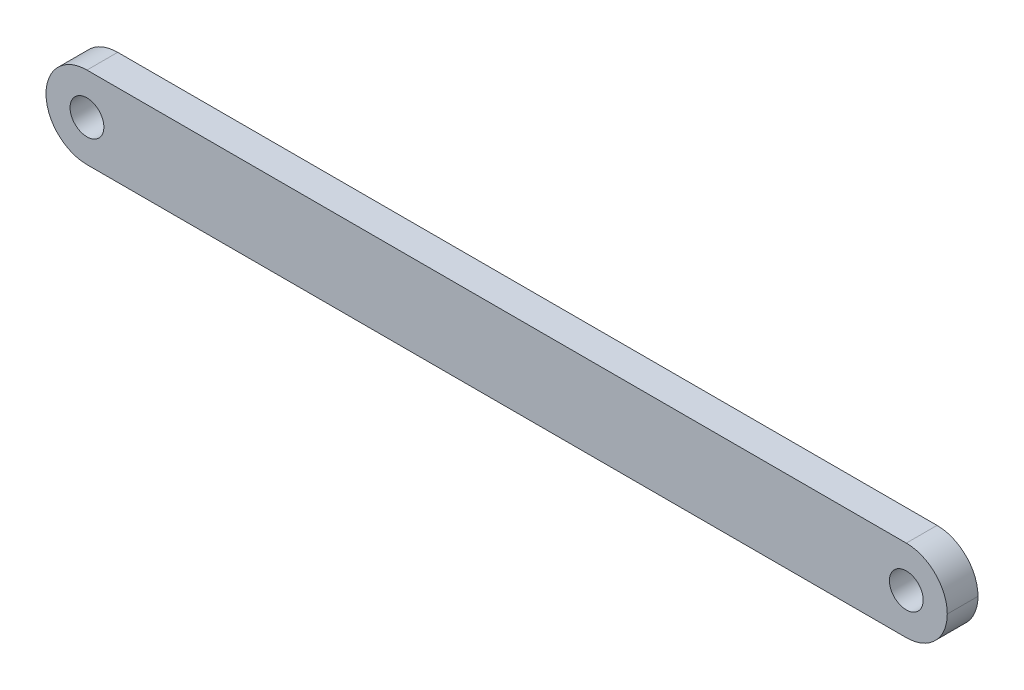
from build123d import *

# Parameters (mm, degrees)
SKETCH_1_R          = 1.3
SKETCH_1_R_2        = 1.65
EXTRUDE_1_DEPTH     = 3
SKETCH_2_R          = 1.65
CUT_EXTRUDE_1_DEPTH = 61.466769186
CUT_EXTRUDE_2_DEPTH = 1


with BuildPart() as part:
    # 草图1 → 凸台-拉伸1 (new body)
    with BuildSketch(Plane(origin=(0, 0, 0), x_dir=(-1, 0, 0), z_dir=(0, 0, -1))):
        with BuildLine():
            Line((-55.860221974, 0), (24.13832066, 0))
            ThreePointArc((24.13832066, 0), (26.966394209, 1.171219344), (28.138320535, 3.999))
            ThreePointArc((28.138320535, 3.999), (26.96674766, 6.827427125), (24.138320535, 7.999))
            Line((24.138320535, 7.999), (-55.860222099, 7.999))
            ThreePointArc((-55.860222099, 7.999), (-58.688295648, 6.827780656), (-59.860221974, 4))
            ThreePointArc((-59.860221974, 4), (-58.688649099, 1.171572875), (-55.860221974, 0))
        make_face()
        with Locations((24.138809001, 3.998511534)):
            Circle(SKETCH_1_R, mode=Mode.SUBTRACT)
        with Locations((-55.859733508, 3.999511534)):
            Circle(SKETCH_1_R_2, mode=Mode.SUBTRACT)
    extrude(amount=-EXTRUDE_1_DEPTH)

    # 草图2 → 切除-拉伸1 (cut, through all)
    with BuildSketch(Plane.XY.offset(3)):
        with Locations((-24.138809001, 3.998511534)):
            Circle(SKETCH_2_R)
    extrude(amount=-CUT_EXTRUDE_1_DEPTH, mode=Mode.SUBTRACT)

    # 草图3 → 切除-拉伸2 (cut)
    with BuildSketch(Plane(origin=(0, 0, 0), x_dir=(-1, 0, 0), z_dir=(0, 0, -1))):
        with BuildLine():
            Line((-16.710668713, 5.336154662), (-16.468781693, 5.146150656))
            Line((-16.468781693, 5.146150656), (-17.393561341, 3.731987996))
            add(Edge.make_bspline(
                [(-17.393561341, 3.731987996), (-17.331991064, 3.741801856), (-17.211891277, 3.760944901), (-17.090325379, 3.764102847), (-17.031081373, 3.765641842)],
                knots=[0, 0, 0, 0, 1.025318673, 2, 2, 2, 2], degree=3))
            add(Edge.make_bspline(
                [(-17.031081373, 3.765641842), (-16.995508877, 3.76468573), (-16.925485476, 3.762803653), (-16.822678674, 3.748319802), (-16.723889738, 3.72549469), (-16.629528126, 3.692222434), (-16.539255144, 3.64972008), (-16.452552748, 3.59878121), (-16.371050738, 3.536775529), (-16.293699558, 3.467510573), (-16.223472461, 3.390793589), (-16.161296405, 3.309392252), (-16.109069614, 3.223391371), (-16.066695692, 3.132834505), (-16.033790813, 3.037861246), (-16.009803168, 2.938593106), (-15.995623576, 2.834961635), (-15.993698085, 2.76448346), (-15.992719995, 2.728682707)],
                knots=[0, 0, 0, 0, 1.04369286, 2.054478336, 3.041073146, 4.015093852, 4.984733326, 5.965804835, 6.960378782, 7.985147595, 9.009457201, 10.008161701, 10.986880575, 11.956520048, 12.937015923, 13.931873656, 14.949455224, 16, 16, 16, 16], degree=3))
            add(Edge.make_bspline(
                [(-15.992719995, 2.728682707), (-15.9941431, 2.679703003), (-15.996943433, 2.583322537), (-16.024847229, 2.442945831), (-16.068206874, 2.309213315), (-16.130184402, 2.184260144), (-16.207166785, 2.068257574), (-16.301044378, 1.965472109), (-16.408487866, 1.873802072), (-16.529974665, 1.797145453), (-16.660717629, 1.734542402), (-16.798069626, 1.689577159), (-16.940696772, 1.66189369), (-17.03750138, 1.658423087), (-17.086469995, 1.656667483)],
                knots=[0, 0, 0, 0, 1.031375318, 2.029502543, 3.004789286, 3.987476834, 4.960371455, 5.9300674, 6.912260825, 7.929083631, 8.949397511, 9.960523116, 10.96833055, 12, 12, 12, 12], degree=3))
            add(Edge.make_bspline(
                [(-17.086469995, 1.656667483), (-17.133566695, 1.658195689), (-17.226857013, 1.661222797), (-17.364089808, 1.688188735), (-17.495952825, 1.731895837), (-17.621522206, 1.792110116), (-17.737842819, 1.868167999), (-17.841908455, 1.959730278), (-17.93320023, 2.064839743), (-18.009174851, 2.18348009), (-18.069433583, 2.310970048), (-18.114623508, 2.443907204), (-18.141019751, 2.581807186), (-18.144708308, 2.675288325), (-18.146566149, 2.722372611)],
                knots=[0, 0, 0, 0, 1.012016664, 2.004627821, 2.994792927, 3.992885782, 4.990978636, 5.973936114, 6.964471063, 7.975201453, 8.993600317, 9.990122807, 10.98767138, 12, 12, 12, 12], degree=3))
            add(Edge.make_bspline(
                [(-18.146566149, 2.722372611), (-18.145384704, 2.758417194), (-18.142972419, 2.832013346), (-18.126129028, 2.943477374), (-18.099064233, 3.057528456), (-18.068753987, 3.15428265), (-18.036728377, 3.233544172), (-18.010075837, 3.297447662), (-17.976901841, 3.363208735), (-17.94152846, 3.433082371), (-17.900771591, 3.505267804), (-17.856455942, 3.580971474), (-17.807356291, 3.658989401), (-17.772936128, 3.711933596), (-17.755340187, 3.738999214)],
                knots=[0, 0, 0, 0, 1.173818275, 2.396712641, 3.66331629, 4.989737886, 5.693666774, 6.447286557, 7.243889047, 8.091586357, 8.998013824, 9.943181721, 10.948533338, 12, 12, 12, 12], degree=3))
            Line((-17.755340187, 3.738999214), (-16.710668713, 5.336154662))
        make_face()
        with BuildLine():
            add(Edge.make_bspline(
                [(-17.096986822, 3.406667483), (-17.123649066, 3.405889439), (-17.175728176, 3.404369694), (-17.252135591, 3.395544442), (-17.324448842, 3.378925376), (-17.393625976, 3.357759044), (-17.458373679, 3.328655985), (-17.519162518, 3.293304186), (-17.57622757, 3.251683008), (-17.628971122, 3.204382096), (-17.676790785, 3.152594064), (-17.717971916, 3.097124541), (-17.753494316, 3.039310338), (-17.782376135, 2.978668396), (-17.804866211, 2.915221896), (-17.821134462, 2.849262647), (-17.830188213, 2.780348341), (-17.831694444, 2.733615838), (-17.832463584, 2.709752419)],
                knots=[0, 0, 0, 0, 1.129588631, 2.206414736, 3.251139165, 4.268635594, 5.265702196, 6.250456724, 7.242448911, 8.251968645, 9.246821453, 10.222880186, 11.173611482, 12.116736599, 13.062300278, 14.020270554, 14.989073742, 16, 16, 16, 16], degree=3))
            add(Edge.make_bspline(
                [(-17.832463584, 2.709752419), (-17.831837223, 2.686102439), (-17.830609021, 2.639728349), (-17.819456701, 2.57138917), (-17.802421619, 2.505624261), (-17.777081223, 2.442772662), (-17.746854335, 2.381876344), (-17.706949011, 2.325141059), (-17.662732225, 2.269120989), (-17.609878292, 2.218119517), (-17.553154929, 2.170662893), (-17.492553726, 2.12918264), (-17.429393766, 2.093696466), (-17.362822344, 2.065885369), (-17.29378396, 2.043061082), (-17.221703406, 2.026999603), (-17.146530551, 2.017919077), (-17.095608613, 2.016410883), (-17.069643072, 2.015641842)],
                knots=[0, 0, 0, 0, 0.989467248, 1.94019797, 2.891935182, 3.827694429, 4.772920941, 5.730924762, 6.725747692, 7.756678648, 8.79901574, 9.819492441, 10.826891316, 11.826466727, 12.835195252, 13.867842842, 14.912794438, 16, 16, 16, 16], degree=3))
            add(Edge.make_bspline(
                [(-17.069643072, 2.015641842), (-17.043677573, 2.016410943), (-16.992755718, 2.017919255), (-16.917582258, 2.026998924), (-16.84550394, 2.043063572), (-16.776457431, 2.065876342), (-16.709916, 2.093729952), (-16.646811278, 2.128961871), (-16.586783185, 2.170917989), (-16.530022585, 2.218038417), (-16.477388647, 2.269411269), (-16.432111368, 2.324640992), (-16.393428135, 2.382334887), (-16.361993948, 2.442532777), (-16.336932657, 2.505662265), (-16.319811189, 2.571378989), (-16.3086819, 2.639731015), (-16.307450534, 2.686103339), (-16.306822559, 2.709752419)],
                knots=[0, 0, 0, 0, 1.087397944, 2.132534446, 3.165364764, 4.174271784, 5.174024072, 6.181601208, 7.194203697, 8.236725232, 9.267838612, 10.269026844, 11.221737037, 12.171628256, 13.107553087, 14.05945871, 15.010357665, 16, 16, 16, 16], degree=3))
            add(Edge.make_bspline(
                [(-16.306822559, 2.709752419), (-16.307372852, 2.73364697), (-16.308452898, 2.780544202), (-16.320668847, 2.84923182), (-16.33761122, 2.915557027), (-16.363194251, 2.979102976), (-16.396430796, 3.039618903), (-16.436914203, 3.097410504), (-16.483746773, 3.152920851), (-16.537844313, 3.20448366), (-16.596734547, 3.251630737), (-16.659350132, 3.293250294), (-16.724858106, 3.328375271), (-16.793192048, 3.357682373), (-16.865134931, 3.378831847), (-16.93952527, 3.39548509), (-17.017314513, 3.404347108), (-17.070091121, 3.405884173), (-17.096986822, 3.406667483)],
                knots=[0, 0, 0, 0, 0.978206639, 1.919901502, 2.851605144, 3.780102724, 4.718870031, 5.675451981, 6.667674623, 7.690630536, 8.733308323, 9.756129687, 10.767539656, 11.776269907, 12.797430371, 13.836405707, 14.897401972, 16, 16, 16, 16], degree=3))
        make_face(mode=Mode.SUBTRACT)
    extrude(amount=-CUT_EXTRUDE_2_DEPTH, mode=Mode.SUBTRACT)


solid = part.part
